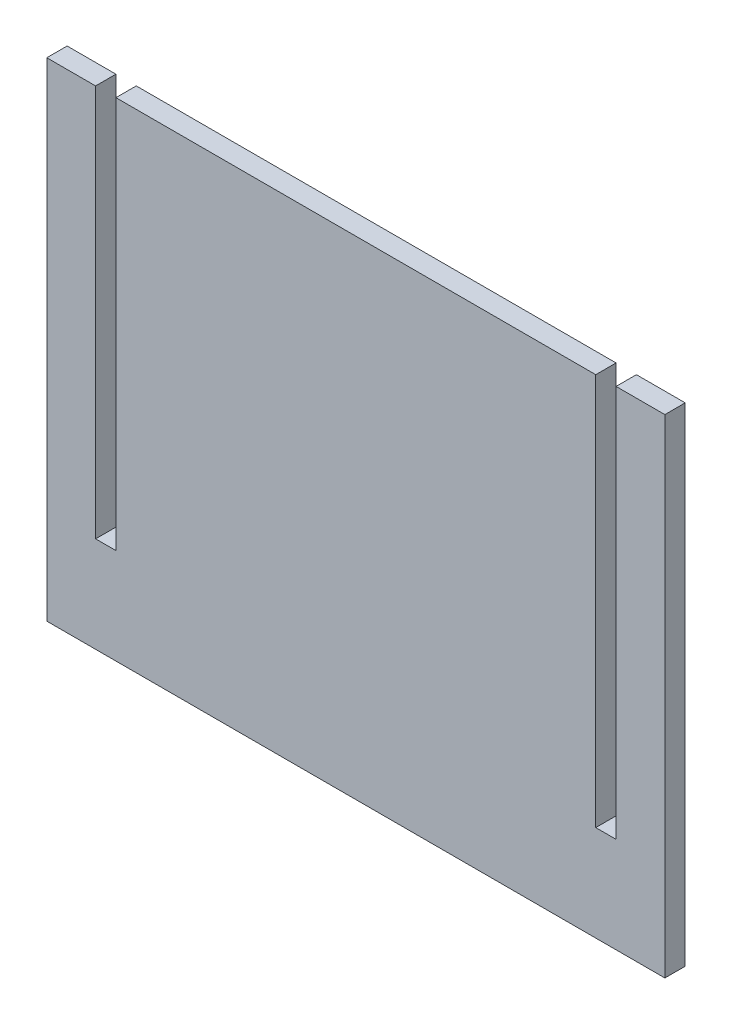
from build123d import *

# Parameters (mm, degrees)
BOSS_EXTRUDE1_DEPTH = 3.175


with BuildPart() as part:
    # Sketch1 → Boss-Extrude1 (new body)
    with BuildSketch(Plane.XY):
        Polygon((48.26, 0), (48.26, 76.2), (10.795, 76.2), (10.795, 14.942805851), (7.62, 14.942805851), (7.62, 76.2), (0, 76.2), (0, 0), align=None)
        Polygon((85.725, 76.2), (48.26, 76.2), (48.26, 0), (96.52, 0), (96.52, 76.2), (88.9, 76.2), (88.9, 14.942805851), (85.725, 14.942805851), align=None)
    extrude(amount=BOSS_EXTRUDE1_DEPTH)


solid = part.part
